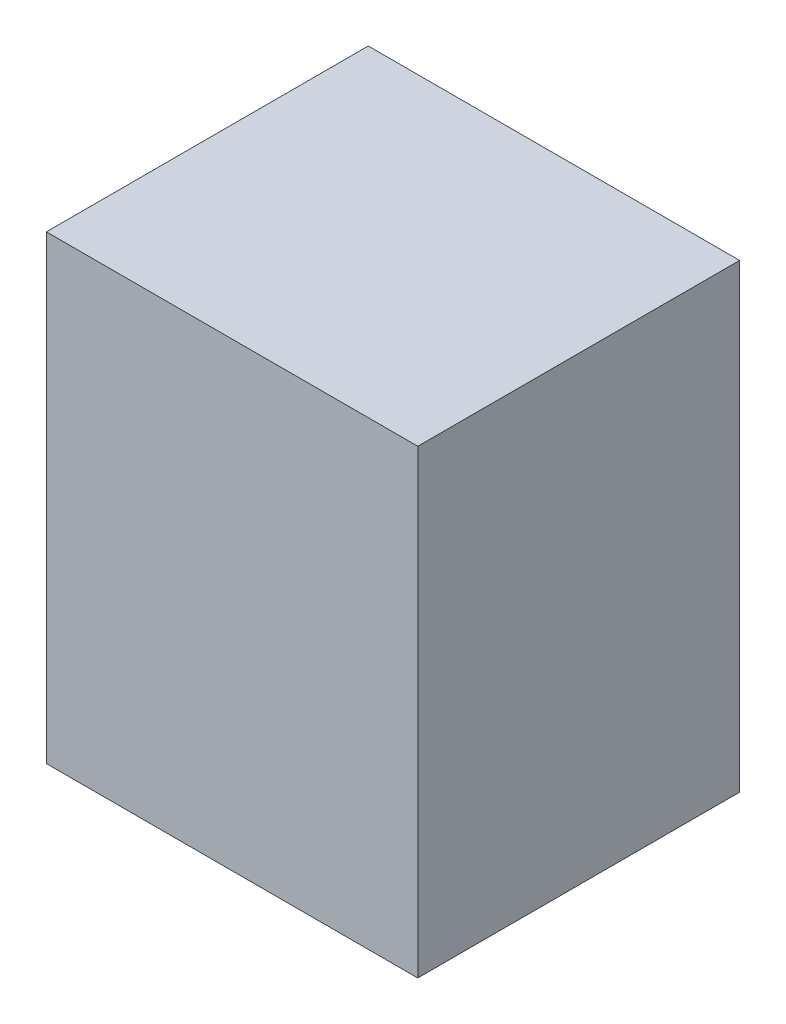
from build123d import *

# Parameters (mm, degrees)
SKIZZE1_W                       = 75
SKIZZE1_H                       = 65
AUFSATZ_LINEAR_AUSTRAGEN1_DEPTH = 93


with BuildPart() as part:
    # Skizze1 → Aufsatz-Linear austragen1 (new body)
    with BuildSketch(Plane(origin=(0, 0, 0), x_dir=(1, 0, 0), z_dir=(0, 1, 0))):
        Rectangle(SKIZZE1_W, SKIZZE1_H)
    extrude(amount=AUFSATZ_LINEAR_AUSTRAGEN1_DEPTH)


solid = part.part
